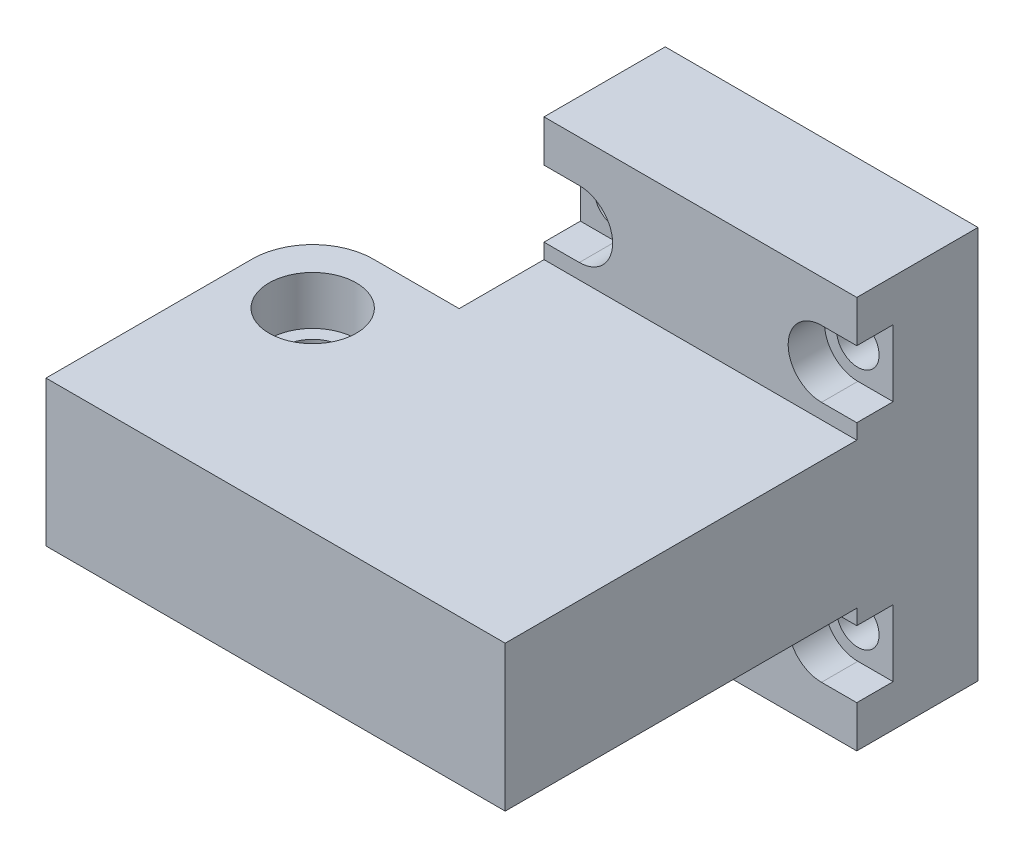
from build123d import *

# Parameters (mm, degrees)
ESQUISSE1_W             = 25.8
ESQUISSE1_H             = 32.4
BOSS_EXTRU_1_DEPTH      = 10
ESQUISSE2_W             = 25.8
ESQUISSE2_H             = 12
BOSS_EXTRU_2_DEPTH      = 29
ESQUISSE3_R             = 2.75
ENL_V_MAT_EXTRU_1_DEPTH = 3
ESQUISSE4_R             = 1.75
ENL_V_MAT_EXTRU_2_DEPTH = 7
ESQUISSE5_W             = 22
ESQUISSE5_H             = 12
BOSS_EXTRU_3_DEPTH      = 12.08
CONG_1_R                = 5
ENL_V_START             = -12
ESQUISSE6_R             = 2.5
ENL_V_MAT_EXTRU_3_DEPTH = 12
ESQUISSE7_R             = 3.6
ENL_V_MAT_EXTRU_4_DEPTH = 4
ESQUISSE8_W             = 2.91
ESQUISSE8_H             = 5.5
ENL_V_MAT_EXTRU_5_DEPTH = 3


with BuildPart() as part:
    # Esquisse1 → Boss.-Extru.1 (new body)
    with BuildSketch(Plane.XY):
        with Locations((2.080747766, -4.221428571)):
            Rectangle(ESQUISSE1_W, ESQUISSE1_H)
    extrude(amount=BOSS_EXTRU_1_DEPTH)

    # Esquisse2 → Boss.-Extru.2 (add)
    with BuildSketch(Plane.XY.offset(10)):
        with Locations((2.080747766, -4.221428571)):
            Rectangle(ESQUISSE2_W, ESQUISSE2_H)
    extrude(amount=BOSS_EXTRU_2_DEPTH)

    # Esquisse3 → Enlèv. mat.-Extru.1 (cut)
    with BuildSketch(Plane.XY.offset(10)):
        with Locations((12.070747766, 5.778571429)):
            Circle(ESQUISSE3_R)
        with Locations((-7.909252234, 5.778571429)):
            Circle(ESQUISSE3_R)
        with Locations((-7.909252234, -14.221428571)):
            Circle(ESQUISSE3_R)
        with Locations((12.070747766, -14.221428571)):
            Circle(ESQUISSE3_R)
    extrude(amount=-ENL_V_MAT_EXTRU_1_DEPTH, mode=Mode.SUBTRACT)

    # Esquisse4 → Enlèv. mat.-Extru.2 (cut)
    with BuildSketch(Plane.XY.offset(7)):
        with Locations((12.070747766, 5.778571429)):
            Circle(ESQUISSE4_R)
        with Locations((-7.909252234, 5.778571429)):
            Circle(ESQUISSE4_R)
        with Locations((12.070747766, -14.221428571)):
            Circle(ESQUISSE4_R)
        with Locations((-7.909252234, -14.221428571)):
            Circle(ESQUISSE4_R)
    extrude(amount=-ENL_V_MAT_EXTRU_2_DEPTH, mode=Mode.SUBTRACT)

    # Esquisse5 → Boss.-Extru.3 (add)
    with BuildSketch(Plane.ZY.offset(10.819252234)):
        with Locations((28, -4.221428571)):
            Rectangle(ESQUISSE5_W, ESQUISSE5_H)
    extrude(amount=BOSS_EXTRU_3_DEPTH)

    # Congé1
    cong_1_edges = [part.edges().sort_by_distance(p)[0] for p in [
        (-22.899252234, -4.221428571, 17),
    ]]
    fillet(cong_1_edges, radius=CONG_1_R)

    # Esquisse6 → Enlèv. mat.-Extru.3 (cut)
    with BuildSketch(Plane.XZ.offset(10.221428571).offset(ENL_V_START)):
        with Locations((-16.899252234, 23)):
            Circle(ESQUISSE6_R)
    extrude(amount=ENL_V_MAT_EXTRU_3_DEPTH, mode=Mode.SUBTRACT)

    # Esquisse7 → Enlèv. mat.-Extru.4 (cut)
    with BuildSketch(Plane(origin=(0, 1.778571429, 0), x_dir=(1, 0, 0), z_dir=(0, 1, 0))):
        with Locations(Location((-16.899252234, -23, 0), (0, 0, 270))):
            Circle(ESQUISSE7_R)
    extrude(amount=-ENL_V_MAT_EXTRU_4_DEPTH, mode=Mode.SUBTRACT)

    # Esquisse8 → Enlèv. mat.-Extru.5 (cut)
    with BuildSketch(Plane.XY.offset(10)):
        with Locations((13.525747766, -14.221428571)):
            Rectangle(ESQUISSE8_W, ESQUISSE8_H)
        with Locations((13.525747766, 5.778571429)):
            Rectangle(ESQUISSE8_W, ESQUISSE8_H)
        with Locations((-9.364252234, 5.778571429)):
            Rectangle(ESQUISSE8_W, ESQUISSE8_H)
        with Locations((-9.364252234, -14.221428571)):
            Rectangle(ESQUISSE8_W, ESQUISSE8_H)
    extrude(amount=-ENL_V_MAT_EXTRU_5_DEPTH, mode=Mode.SUBTRACT)


solid = part.part
